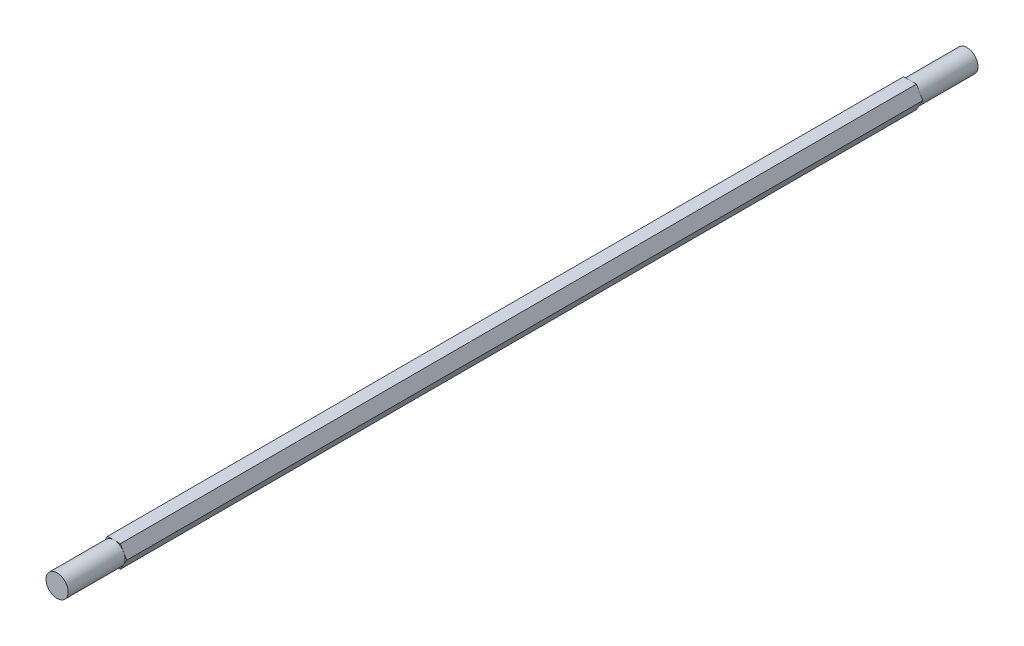
from build123d import *

# Parameters (mm, degrees)
BOSS_EXTRUDE1_DEPTH      = 203.2
BOSS_EXTRUDE1_DEPTH_BACK = 203.2
SKETCH1_R                = 4.953
BOSS_EXTRUDE2_DEPTH      = 177.8
BOSS_EXTRUDE2_DEPTH_BACK = 177.8


with BuildPart() as part:
    # Sketch1 → Boss-Extrude1 (new, two sides: drawn at the far end of the back side and taken through both)
    with BuildSketch(Plane.XY.offset(-BOSS_EXTRUDE1_DEPTH_BACK)):
        Circle(SKETCH1_R)
    extrude(amount=BOSS_EXTRUDE1_DEPTH + BOSS_EXTRUDE1_DEPTH_BACK)

    # Sketch2 → Boss-Extrude2 (add, two sides: drawn at the far end of the back side and taken through both)
    with BuildSketch(Plane.XY.offset(-BOSS_EXTRUDE2_DEPTH_BACK)):
        Polygon((5.719231767, 0), (2.859615883, 4.953), (-2.859615883, 4.953), (-5.719231767, 0), (-2.859615883, -4.953), (2.859615883, -4.953), align=None)
    extrude(amount=BOSS_EXTRUDE2_DEPTH + BOSS_EXTRUDE2_DEPTH_BACK)


solid = part.part
